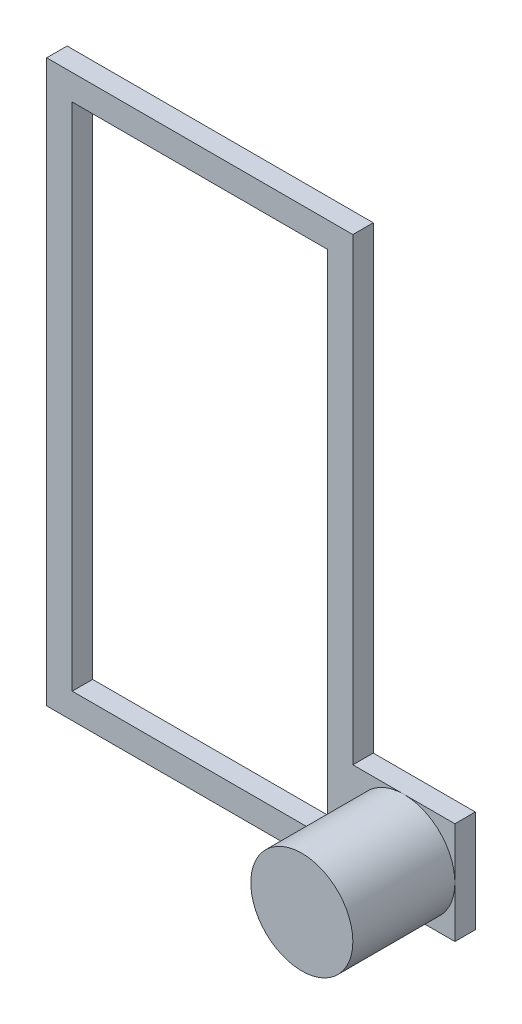
from build123d import *

# Parameters (mm, degrees)
BOSS_EXTRUDE1_DEPTH = 2.54
SKETCH2_W           = 31.75
SKETCH2_H           = 63.5
CUT_EXTRUDE1_DEPTH  = 48.268062421
SKETCH3_R           = 6.35
BOSS_EXTRUDE2_DEPTH = 12.7


with BuildPart() as part:
    # Sketch1 → Boss-Extrude1 (new body)
    with BuildSketch(Plane.XY):
        Polygon((-19.05, -34.925), (19.05, -34.925), (31.75, -34.925), (31.75, -22.225), (19.05, -22.225), (19.05, 34.925), (-19.05, 34.925), align=None)
    extrude(amount=BOSS_EXTRUDE1_DEPTH)

    # Sketch2 → Cut-Extrude1 (cut, through all)
    with BuildSketch(Plane.XY.offset(2.54)):
        Rectangle(SKETCH2_W, SKETCH2_H)
    extrude(amount=-CUT_EXTRUDE1_DEPTH, mode=Mode.SUBTRACT)

    # Sketch3 → Boss-Extrude2 (add)
    with BuildSketch(Plane.XY.offset(2.54)):
        with Locations((25.4, -28.575)):
            Circle(SKETCH3_R)
    extrude(amount=BOSS_EXTRUDE2_DEPTH)


solid = part.part
